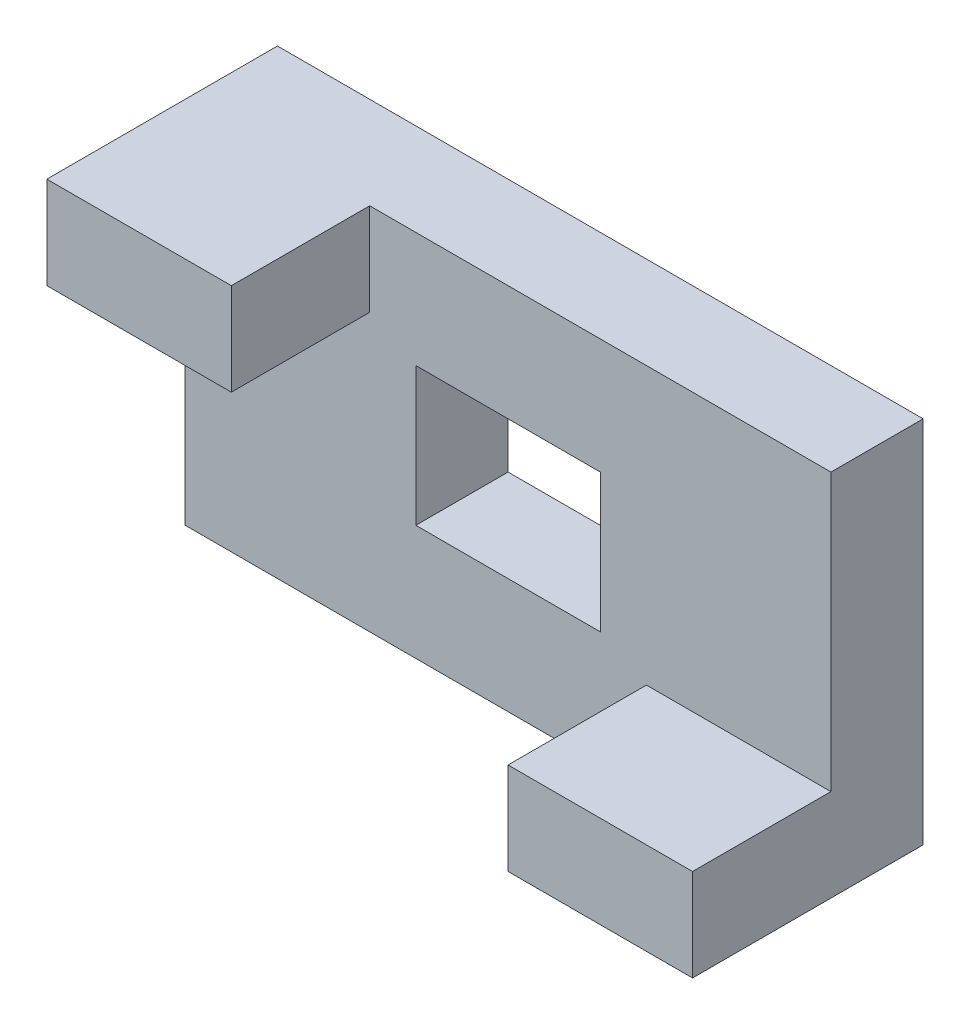
from build123d import *

# Parameters (mm, degrees)
SKETCH1_W           = 16
SKETCH1_H           = 12
BOSS_EXTRUDE3_DEPTH = 8
SKETCH1_5_W         = 16
SKETCH1_5_H         = 8
BOSS_EXTRUDE4_DEPTH = 20


with BuildPart() as part:
    # Sketch1 → Boss-Extrude3 (new body)
    with BuildSketch(Plane.XY):
        Polygon((0, -32), (40, -32), (40, -24), (56, -24), (56, 0), (16, 0), (16, -8), (0, -8), align=None)
        with Locations((28, -16)):
            Rectangle(SKETCH1_W, SKETCH1_H, mode=Mode.SUBTRACT)
    extrude(amount=BOSS_EXTRUDE3_DEPTH)

    # Sketch1<5> → Boss-Extrude4 (add)
    with BuildSketch(Plane.XY):
        with Locations((48, -28)):
            Rectangle(SKETCH1_5_W, SKETCH1_5_H)
        with Locations((8, -4)):
            Rectangle(SKETCH1_5_W, SKETCH1_5_H)
    extrude(amount=BOSS_EXTRUDE4_DEPTH)


solid = part.part
